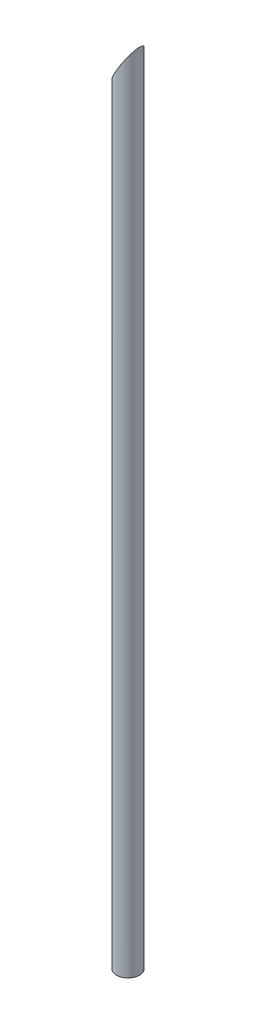
from build123d import *

# Parameters (mm, degrees)
SKETCH1_R               = 16.7005
SKETCH1_R_2             = 13.3223
BOSS_EXTRUDE1_DEPTH     = 1168.4
CUT_EXTRUDE1_DEPTH      = 1169.638683854
CUT_EXTRUDE1_DEPTH_BACK = 1169.638683854


with BuildPart() as part:
    # Sketch1 → Boss-Extrude1 (new body)
    with BuildSketch(Plane(origin=(0, 0, 0), x_dir=(1, 0, 0), z_dir=(0, 1, 0))):
        with Locations(Location((0, 0, 0), (0, 0, 270))):
            Circle(SKETCH1_R)
        with Locations(Location((0, 0, 0), (0, 0, 270))):
            Circle(SKETCH1_R_2, mode=Mode.SUBTRACT)
    extrude(amount=BOSS_EXTRUDE1_DEPTH)

    # Sketch2 → Cut-Extrude1 (cut, two sides: drawn at the far end of the back side and taken through both)
    with BuildSketch(Plane.XY.offset(-CUT_EXTRUDE1_DEPTH_BACK)):
        Polygon((16.7005, 1168.4), (-16.7005, 1168.4), (-16.7005, 1110.547770976), align=None)
    extrude(amount=CUT_EXTRUDE1_DEPTH + CUT_EXTRUDE1_DEPTH_BACK, mode=Mode.SUBTRACT)


solid = part.part
